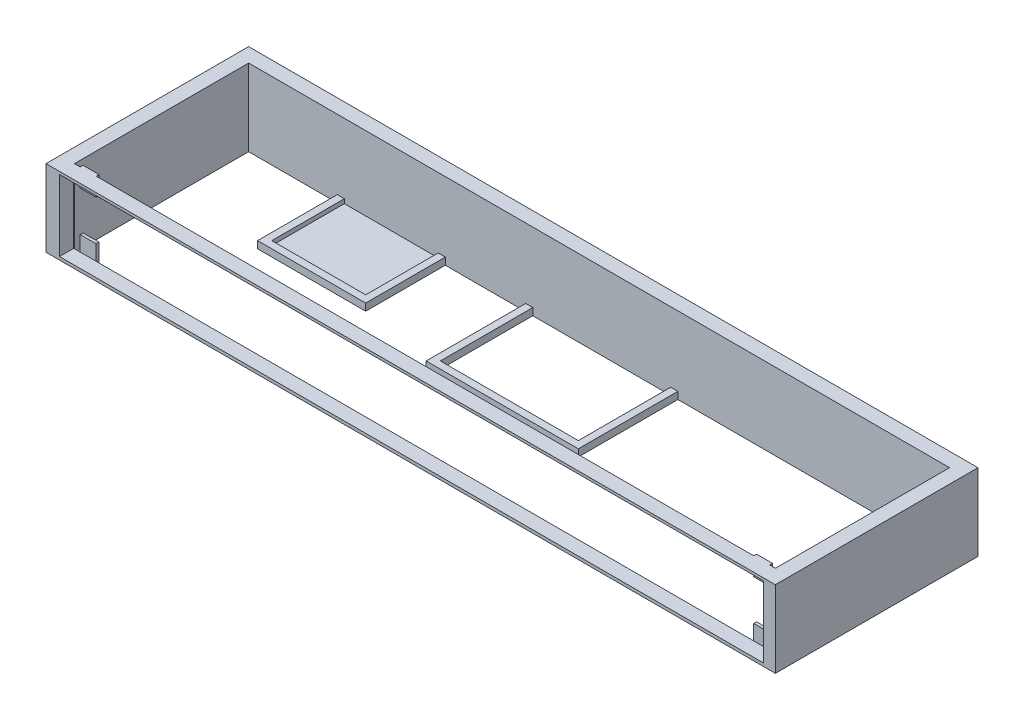
from build123d import *

# Parameters (mm, degrees)
SKETCH2_W               = 512.8
SKETCH2_H               = 142.48
SKETCH2_W_2             = 492.8
SKETCH2_H_2             = 122.48
EXTRUDE_THIN1_DEPTH     = 54
SKETCH3_W               = 495
SKETCH3_H               = 50
CUT_EXTRUDE1_DEPTH      = 10
SKETCH4_W               = 11.198987657
SKETCH4_H               = 12.828632872
BOSS_EXTRUDE1_DEPTH     = 2
MIRROR3_COPY_1_SKETCH_W = 11.198987657
MIRROR3_COPY_1_SKETCH_H = 12.828632872
MIRROR3_COPY_1_DEPTH    = 2
MIRROR3_COPY_2_SKETCH_W = 11.198987657
MIRROR3_COPY_2_SKETCH_H = 12.828632872
MIRROR3_COPY_2_DEPTH    = 2
SKETCH5_W               = 5
SKETCH5_H               = 5
BOSS_EXTRUDE2_DEPTH     = 70
SKETCH7_W               = 5
SKETCH7_H               = 5
BOSS_EXTRUDE3_DEPTH     = 102
SKETCH8_W               = 5
SKETCH8_H               = 5
BOSS_EXTRUDE4_DEPTH     = 65
SKETCH9_W               = 5
SKETCH9_H               = 5
BOSS_EXTRUDE5_DEPTH     = 56
SKETCH10_W              = 5
SKETCH10_H              = 5
BOSS_EXTRUDE6_DEPTH     = 71
SKETCH11_W              = 5
SKETCH11_H              = 5
BOSS_EXTRUDE7_DEPTH     = 51
SKETCH14_W              = 51
SKETCH14_H              = 2
BOSS_EXTRUDE8_DEPTH     = 66


with BuildPart() as part:
    # Sketch2 → Extrude-Thin1 (new body)
    with BuildSketch(Plane(origin=(0, 0, 0), x_dir=(1, 0, 0), z_dir=(0, 1, 0))):
        with Locations((0, 0.16)):
            Rectangle(SKETCH2_W, SKETCH2_H)
        with Locations((0, 0.16)):
            Rectangle(SKETCH2_W_2, SKETCH2_H_2, mode=Mode.SUBTRACT)
    extrude(amount=EXTRUDE_THIN1_DEPTH)

    # Sketch3 → Cut-Extrude1 (cut)
    with BuildSketch(Plane.XY.offset(71.08)):
        with Locations((0.567740689, 27.1414334)):
            Rectangle(SKETCH3_W, SKETCH3_H)
    extrude(amount=-CUT_EXTRUDE1_DEPTH, mode=Mode.SUBTRACT)

    # Sketch4 → Boss-Extrude1 (add)
    with BuildSketch(Plane(origin=(0, 0, 61.08), x_dir=(-1, 0, 0), z_dir=(0, 0, -1))):
        with Locations((236.763190304, 47.585683564)):
            Rectangle(SKETCH4_W, SKETCH4_H)
    boss_extrude1 = extrude(amount=BOSS_EXTRUDE1_DEPTH)

    # Mirror1: Boss-Extrude1 across plane
    add(boss_extrude1.mirror(Plane(origin=(0, 0, 0), x_dir=(0, 0, 1), z_dir=(1, 0, 0))))

    # Mirror2: Boss-Extrude1 across plane
    add(boss_extrude1.mirror(Plane.ZX.offset(27)))

    # Mirror3 copy 1 sketch → Mirror3 copy 1 (add)
    with BuildSketch(Plane(origin=(0, 54, 61.08), x_dir=(1, 0, 0), z_dir=(0, 0, -1))):
        with Locations((236.763190304, 47.585683564)):
            Rectangle(MIRROR3_COPY_1_SKETCH_W, MIRROR3_COPY_1_SKETCH_H)
    extrude(amount=MIRROR3_COPY_1_DEPTH)

    # Mirror3 copy 2 sketch → Mirror3 copy 2 (add)
    with BuildSketch(Plane(origin=(0, 54, 61.08), x_dir=(-1, 0, 0), z_dir=(0, 0, -1))):
        with Locations((236.763190304, -47.585683564)):
            Rectangle(MIRROR3_COPY_2_SKETCH_W, MIRROR3_COPY_2_SKETCH_H)
    extrude(amount=MIRROR3_COPY_2_DEPTH)

    # Sketch5 → Boss-Extrude2 (add)
    with BuildSketch(Plane.XY.offset(-61.4)):
        with Locations((52.881030247, 2.5)):
            Rectangle(SKETCH5_W, SKETCH5_H)
    extrude(amount=BOSS_EXTRUDE2_DEPTH)

    # Sketch7 → Boss-Extrude3 (add)
    with BuildSketch(Plane.ZY.offset(-50.381030247)):
        with Locations((6.1, 2.5)):
            Rectangle(SKETCH7_W, SKETCH7_H)
    extrude(amount=BOSS_EXTRUDE3_DEPTH)

    # Sketch8 → Boss-Extrude4 (add)
    with BuildSketch(Plane(origin=(0, 0, 3.6), x_dir=(-1, 0, 0), z_dir=(0, 0, -1))):
        with Locations((49.118969753, 2.5)):
            Rectangle(SKETCH8_W, SKETCH8_H)
    extrude(amount=BOSS_EXTRUDE4_DEPTH)

    # Sketch9 → Boss-Extrude5 (add)
    with BuildSketch(Plane.XY.offset(-61.4)):
        with Locations((-110.630872861, 2.5)):
            Rectangle(SKETCH9_W, SKETCH9_H)
    extrude(amount=BOSS_EXTRUDE5_DEPTH)

    # Sketch10 → Boss-Extrude6 (add)
    with BuildSketch(Plane.ZY.offset(113.130872861)):
        with Locations((-7.9, 2.5)):
            Rectangle(SKETCH10_W, SKETCH10_H)
    extrude(amount=BOSS_EXTRUDE6_DEPTH)

    # Sketch11 → Boss-Extrude7 (add)
    with BuildSketch(Plane(origin=(0, 0, -10.4), x_dir=(-1, 0, 0), z_dir=(0, 0, -1))):
        with Locations((181.630872861, 2.5)):
            Rectangle(SKETCH11_W, SKETCH11_H)
    extrude(amount=BOSS_EXTRUDE7_DEPTH)

    # Sketch14 → Boss-Extrude8 (add)
    with BuildSketch(Plane(origin=(-179.130872861, 0, 0), x_dir=(0, 0, -1), z_dir=(1, 0, 0))):
        with Locations((35.9, 1)):
            Rectangle(SKETCH14_W, SKETCH14_H)
    extrude(amount=BOSS_EXTRUDE8_DEPTH)


solid = part.part
